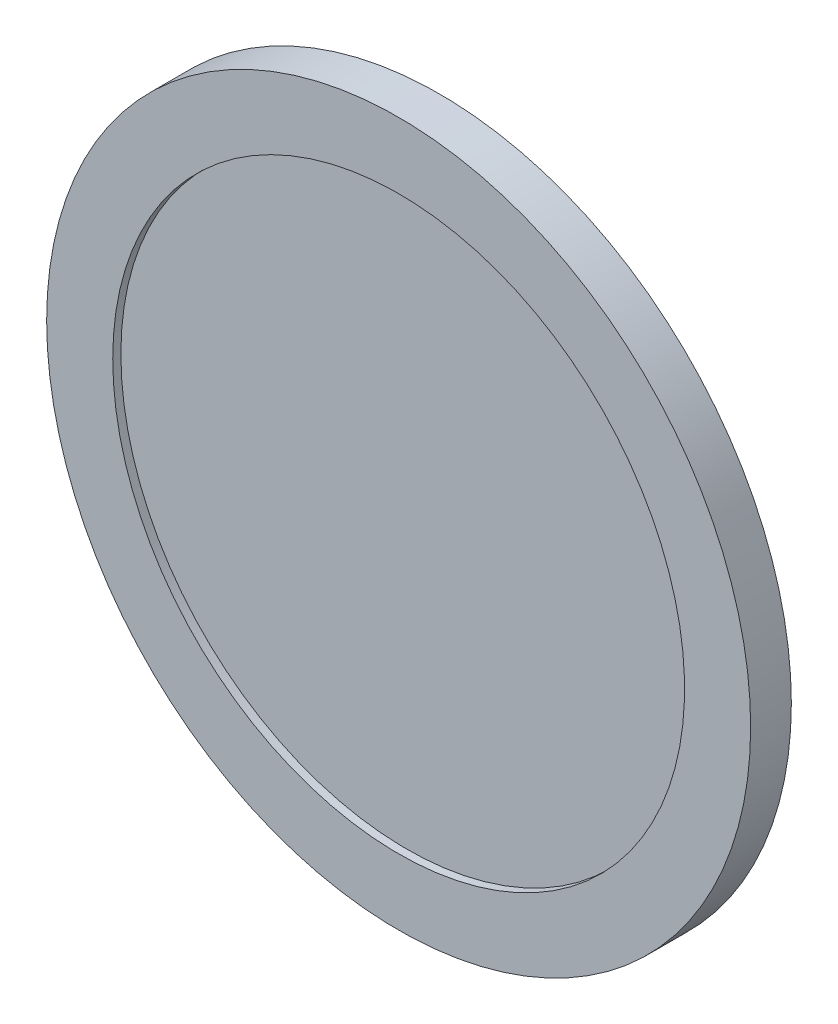
from build123d import *


with BuildPart() as part:
    # Esquisse1 → Révolution1 (revolve)
    with BuildSketch(Plane(origin=(0, 0, 0), x_dir=(0, 0, -1), z_dir=(1, 0, 0)), mode=Mode.PRIVATE) as r_volution1_sk:
        Polygon((0, 0), (0, 70.260725461), (-2, 70.260725461), (-2, 86.5), (8, 86.5), (8, 70.260725461), (6, 70.260725461), (6, 0), align=None)
    revolve(r_volution1_sk.sketch.rotate(Axis((0, 0, -6), (0, 0, 1)), 90), axis=Axis((0, 0, -6), (0, 0, 1)))


solid = part.part
